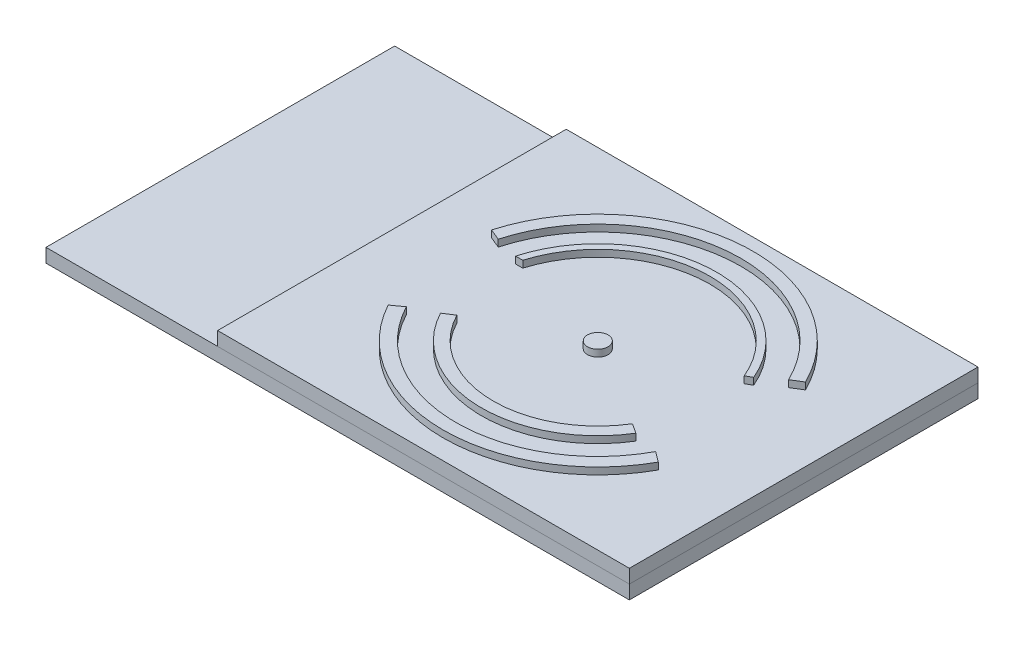
from build123d import *

# Parameters (mm, degrees)
SKETCH1_W             = 42.5
SKETCH1_H             = 25.4
BOSS_EXTRUDE1_DEPTH   = 1
SKETCH2_W             = 30
SKETCH2_H             = 25.4
BOSS_EXTRUDE2_DEPTH   = 1
SKETCH3_R             = 0.75
BOSS_EXTRUDE3_DEPTH   = 0.5
BOSS_EXTRUDE3_2_DEPTH = 0.5
BOSS_EXTRUDE3_3_DEPTH = 0.5
BOSS_EXTRUDE3_4_DEPTH = 0.5
BOSS_EXTRUDE3_5_DEPTH = 0.5


with BuildPart() as part:
    # Sketch1 → Boss-Extrude1 (new body)
    with BuildSketch(Plane(origin=(0, 0, 0), x_dir=(1, 0, 0), z_dir=(0, 1, 0))):
        Rectangle(SKETCH1_W, SKETCH1_H)
    extrude(amount=BOSS_EXTRUDE1_DEPTH)


with BuildPart() as body_2:
    # Sketch2 → Boss-Extrude2 (new body)
    with BuildSketch(Plane(origin=(0, 1, 0), x_dir=(1, 0, 0), z_dir=(0, 1, 0))):
        with Locations((6.25, 0)):
            Rectangle(SKETCH2_W, SKETCH2_H)
    extrude(amount=BOSS_EXTRUDE2_DEPTH)


with BuildPart() as body_3:
    # Sketch3 → Boss-Extrude3 (new body)
    with BuildSketch(Plane(origin=(0, 2, 0), x_dir=(1, 0, 0), z_dir=(0, 1, 0))):
        with Locations(Location((6.25, 0, 0), (0, 0, 270))):
            Circle(SKETCH3_R)
    extrude(amount=BOSS_EXTRUDE3_DEPTH)


with BuildPart() as body_4:
    # Sketch3 → Boss-Extrude3 2 (new body)
    with BuildSketch(Plane(origin=(0, 2, 0), x_dir=(1, 0, 0), z_dir=(0, 1, 0))):
        with BuildLine():
            Line((-4.617762535, 3.127091943), (-3.790050383, 2.78808304))
            ThreePointArc((-3.790050383, 2.78808304), (5.337988327, 10.37999294), (15.650040902, 4.496137205))
            Line((15.650040902, 4.496137205), (16.409882045, 4.966262516))
            ThreePointArc((16.409882045, 4.966262516), (5.264651942, 11.26570263), (-4.617762535, 3.127091943))
        make_face()
    extrude(amount=BOSS_EXTRUDE3_2_DEPTH)


with BuildPart() as body_5:
    # Sketch3 → Boss-Extrude3 3 (new body)
    with BuildSketch(Plane(origin=(0, 2, 0), x_dir=(1, 0, 0), z_dir=(0, 1, 0))):
        with BuildLine():
            Line((-2.09106228, 2.352445065), (-1.56829671, 2.352445065))
            ThreePointArc((-1.56829671, 2.352445065), (5.838769057, 8.154179931), (13.791953143, 3.127091943))
            Line((13.791953143, 3.127091943), (14.233285292, 3.372606364))
            ThreePointArc((14.233285292, 3.372606364), (5.70946012, 8.649574231), (-2.09106228, 2.352445065))
        make_face()
    extrude(amount=BOSS_EXTRUDE3_3_DEPTH)


with BuildPart() as body_6:
    # Sketch3 → Boss-Extrude3 4 (new body)
    with BuildSketch(Plane(origin=(0, 2, 0), x_dir=(1, 0, 0), z_dir=(0, 1, 0))):
        with BuildLine():
            Line((12.746422003, -3.964305573), (13.461213429, -4.443507345))
            ThreePointArc((13.461213429, -4.443507345), (5.983271007, -8.466121443), (-1.226623801, -3.980760378))
            Line((-1.226623801, -3.980760378), (-0.502014789, -3.511340741))
            ThreePointArc((-0.502014789, -3.511340741), (5.989949615, -7.606023357), (12.746422003, -3.964305573))
        make_face()
    extrude(amount=BOSS_EXTRUDE3_4_DEPTH)


with BuildPart() as body_7:
    # Sketch3 → Boss-Extrude3 5 (new body)
    with BuildSketch(Plane(origin=(0, 2, 0), x_dir=(1, 0, 0), z_dir=(0, 1, 0))):
        with BuildLine():
            Line((15.34509432, -4.879145321), (16.104935463, -5.445474688))
            ThreePointArc((16.104935463, -5.445474688), (6.211132045, -11.259282252), (-3.642296578, -5.377305642))
            Line((-3.642296578, -5.377305642), (-2.874726628, -4.823501188))
            ThreePointArc((-2.874726628, -4.823501188), (6.218478804, -10.321133957), (15.34509432, -4.879145321))
        make_face()
    extrude(amount=BOSS_EXTRUDE3_5_DEPTH)


solid = Compound([part.part, body_2.part, body_3.part, body_4.part, body_5.part, body_6.part, body_7.part])
